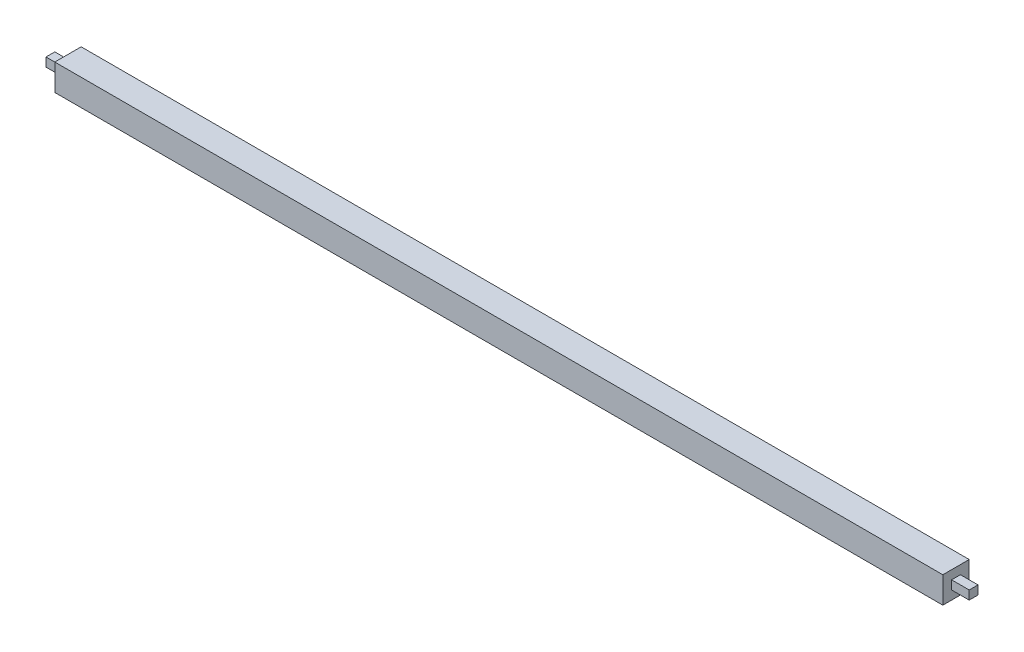
from build123d import *

# Parameters (mm, degrees)
SKICA1_W                = 202
SKICA1_H                = 6
P_IDAT_VYSUNUT_M1_DEPTH = 6
SKICA2_W                = 2
SKICA2_H                = 2
P_IDAT_VYSUNUT_M2_DEPTH = 4
SKICA3_W                = 2
SKICA3_H                = 2
P_IDAT_VYSUNUT_M3_DEPTH = 4


with BuildPart() as part:
    # Skica1 → Přidat vysunutím1 (new body)
    with BuildSketch(Plane(origin=(0, 0, 0), x_dir=(1, 0, 0), z_dir=(0, 1, 0))):
        with Locations((101, 3)):
            Rectangle(SKICA1_W, SKICA1_H)
    extrude(amount=P_IDAT_VYSUNUT_M1_DEPTH)

    # Skica2 → Přidat vysunutím2 (add)
    with BuildSketch(Plane.ZY):
        with Locations((-3, 3)):
            Rectangle(SKICA2_W, SKICA2_H)
    extrude(amount=P_IDAT_VYSUNUT_M2_DEPTH)

    # Skica3 → Přidat vysunutím3 (add)
    with BuildSketch(Plane(origin=(202, 0, 0), x_dir=(0, 0, -1), z_dir=(1, 0, 0))):
        with Locations((3, 3)):
            Rectangle(SKICA3_W, SKICA3_H)
    extrude(amount=P_IDAT_VYSUNUT_M3_DEPTH)


solid = part.part
